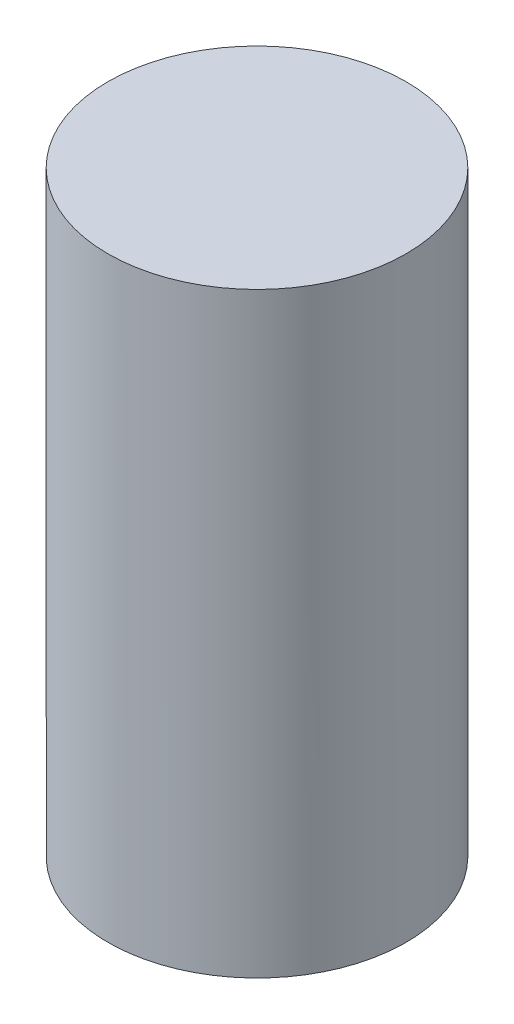
from build123d import *

# Parameters (mm, degrees)
SKETCH1_R           = 5
BOSS_EXTRUDE1_DEPTH = 15
BOSS_EXTRUDE2_START = 2
SKETCH2_R           = 5
SKETCH2_R_2         = 0.8
BOSS_EXTRUDE2_DEPTH = 2
SKETCH3_R           = 5
BOSS_EXTRUDE3_DEPTH = 3


with BuildPart() as part:
    # Sketch1 → Boss-Extrude1 (new body)
    with BuildSketch(Plane(origin=(0, 0, 0), x_dir=(1, 0, 0), z_dir=(0, 1, 0))):
        with Locations(Location((0, 0, 0), (0, 0, 270))):
            Circle(SKETCH1_R)
        with BuildLine():
            Line((1.5, -2.236067977), (1.5, 2.236067977))
            ThreePointArc((1.5, 2.236067977), (1.795875855, 2.692503442), (2.333333333, 2.608745974))
            ThreePointArc((2.333333333, 2.608745974), (3.5, 0), (2.333333333, -2.608745974))
            ThreePointArc((2.333333333, -2.608745974), (1.795875855, -2.692503442), (1.5, -2.236067977))
        make_face(mode=Mode.SUBTRACT)
        with BuildLine():
            Line((-1.5, -2.236067977), (-1.5, 2.236067977))
            ThreePointArc((-1.5, 2.236067977), (-1.795875855, 2.692503442), (-2.333333333, 2.608745974))
            ThreePointArc((-2.333333333, 2.608745974), (-3.5, 0), (-2.333333333, -2.608745974))
            ThreePointArc((-2.333333333, -2.608745974), (-1.795875855, -2.692503442), (-1.5, -2.236067977))
        make_face(mode=Mode.SUBTRACT)
    extrude(amount=BOSS_EXTRUDE1_DEPTH)

    # Sketch2 → Boss-Extrude2 (add)
    with BuildSketch(Plane.XZ.offset(BOSS_EXTRUDE2_START)):
        with Locations(Location((0, 0, 0), (0, 0, 270))):
            Circle(SKETCH2_R)
        with Locations(Location((-2.5, 0, 0), (0, 0, 270))):
            Circle(SKETCH2_R_2, mode=Mode.SUBTRACT)
        with Locations(Location((2.5, 0, 0), (0, 0, 90))):
            Circle(SKETCH2_R_2, mode=Mode.SUBTRACT)
    extrude(amount=-BOSS_EXTRUDE2_DEPTH)

    # Sketch3 → Boss-Extrude3 (add)
    with BuildSketch(Plane(origin=(0, 15, 0), x_dir=(1, 0, 0), z_dir=(0, 1, 0))):
        with Locations(Location((0, 0, 0), (0, 0, 90))):
            Circle(SKETCH3_R)
    extrude(amount=BOSS_EXTRUDE3_DEPTH)


solid = part.part
